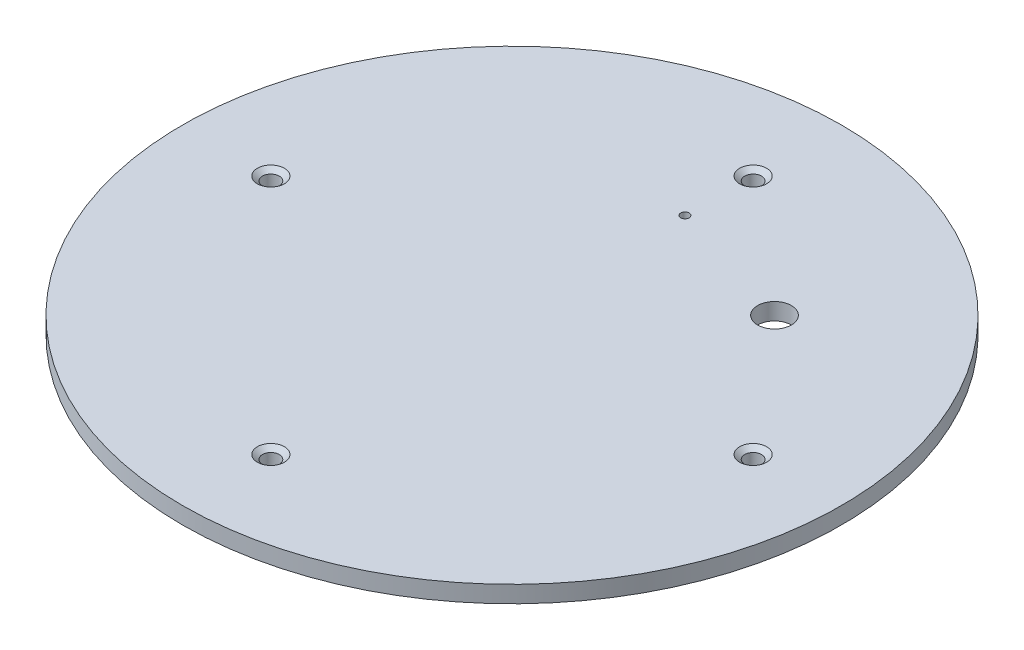
from build123d import *

# Parameters (mm, degrees)
SKETCH1_R                                       = 19.53
BOSS_EXTRUDE1_DEPTH                             = 1
CSK_FOR_M2_FLAT_HEAD_MACHINE_SCREW1_D           = 1
CSK_FOR_M2_FLAT_HEAD_MACHINE_SCREW1_CSINK_D     = 1.6
CSK_FOR_M2_FLAT_HEAD_MACHINE_SCREW1_CSINK_ANGLE = 100
CUT_EXTRUDE1_DEPTH                              = 28.637688036
CUT_EXTRUDE1_DEPTH_BACK                         = 28.637688036
SKETCH5_R                                       = 0.25
SKETCH5_R_2                                     = 1


with BuildPart() as part:
    # Sketch1 → Boss-Extrude1 (new body)
    with BuildSketch(Plane(origin=(0, 0, 0), x_dir=(1, 0, 0), z_dir=(0, 1, 0))):
        with Locations(Location((0, 0, 0), (0, 0, 270))):
            Circle(SKETCH1_R)
    extrude(amount=BOSS_EXTRUDE1_DEPTH)

    # CSK for M2 Flat Head Machine Screw1 (through all)
    with Locations(Plane(origin=(0, 1, 0), x_dir=(1, 0, 0), z_dir=(0, 1, 0))):
        with Locations((0, 14.29), (14.29, 0), (0, -14.29), (-14.29, 0)):
            CounterSinkHole(CSK_FOR_M2_FLAT_HEAD_MACHINE_SCREW1_D / 2, CSK_FOR_M2_FLAT_HEAD_MACHINE_SCREW1_CSINK_D / 2, counter_sink_angle=CSK_FOR_M2_FLAT_HEAD_MACHINE_SCREW1_CSINK_ANGLE)

    # Sketch5 → Cut-Extrude1 (cut, two sides: drawn at the far end of the back side and taken through both)
    with BuildSketch(Plane(origin=(0, 1, 0), x_dir=(1, 0, 0), z_dir=(0, 1, 0)).offset(-CUT_EXTRUDE1_DEPTH_BACK)):
        with Locations(Location((0, 10.25, 0), (0, 0, 270))):
            Circle(SKETCH5_R)
        with Locations(Location((7.778174593, 7.778174593, 0), (0, 0, 270))):
            Circle(SKETCH5_R_2)
    extrude(amount=CUT_EXTRUDE1_DEPTH + CUT_EXTRUDE1_DEPTH_BACK, mode=Mode.SUBTRACT)


solid = part.part
